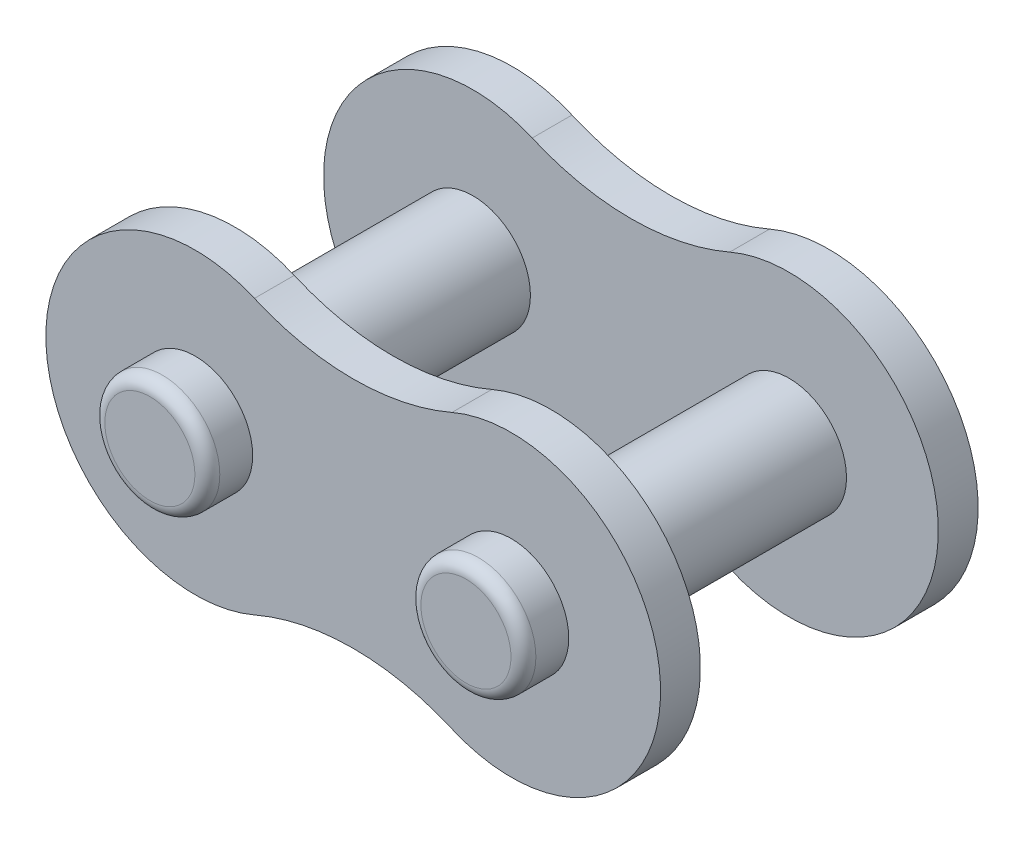
from build123d import *

# Parameters (mm, degrees)
EXTRUDE_1_DEPTH = 0.8
SKETCH_2_R      = 1.155
EXTRUDE_2_DEPTH = 4.78
EXTRUDE_3_DEPTH = 0.8
SKETCH_4_R      = 1.155
EXTRUDE_4_DEPTH = 0.91
EXTRUDE_START   = 0.91
SKETCH_5_R      = 1.155
EXTRUDE_5_DEPTH = 0.91
FILLET_1_R      = 0.25


with BuildPart() as part:
    # 草图1 → 凸台-拉伸1 (new body)
    with BuildSketch(Plane.XY):
        with BuildLine():
            ThreePointArc((1.190625, 2.753618004), (-3, 0), (1.190625, -2.753618004))
            ThreePointArc((1.190625, -2.753618004), (3.175, -2.342981343), (5.159375, -2.753618004))
            ThreePointArc((5.159375, -2.753618004), (9.35, 0), (5.159375, 2.753618004))
            ThreePointArc((5.159375, 2.753618004), (3.175, 2.342981343), (1.190625, 2.753618004))
        make_face()
    extrude(amount=EXTRUDE_1_DEPTH)

    # 草图2 → 凸台-拉伸2 (add)
    with BuildSketch(Plane.XY.offset(0.8)):
        Circle(SKETCH_2_R)
        with Locations((6.35, 0)):
            Circle(SKETCH_2_R)
    extrude(amount=EXTRUDE_2_DEPTH)

    # 草图3 → 凸台-拉伸3 (add)
    with BuildSketch(Plane.XY.offset(5.58)):
        with BuildLine():
            ThreePointArc((5.159375, -2.753618004), (3.175, -2.342981343), (1.190625, -2.753618004))
            ThreePointArc((1.190625, -2.753618004), (-3, 0), (1.190625, 2.753618004))
            ThreePointArc((1.190625, 2.753618004), (3.175, 2.342981343), (5.159375, 2.753618004))
            ThreePointArc((5.159375, 2.753618004), (9.35, 0), (5.159375, -2.753618004))
        make_face()
    extrude(amount=EXTRUDE_3_DEPTH)

    # 草图4 → 凸台-拉伸4 (add)
    with BuildSketch(Plane.XY.offset(6.38)):
        Circle(SKETCH_4_R)
        with Locations((6.35, 0)):
            Circle(SKETCH_4_R)
    extrude(amount=EXTRUDE_4_DEPTH)

    # 草图5 → 凸台-拉伸5 (add)
    with BuildSketch(Plane(origin=(0, 0, 0), x_dir=(-1, 0, 0), z_dir=(0, 0, -1)).offset(EXTRUDE_START)):
        with Locations(Location((0, 0, 0), (0, 0, 180))):
            Circle(SKETCH_5_R)
        with Locations(Location((-6.35, 0, 0), (0, 0, 180))):
            Circle(SKETCH_5_R)
    extrude(amount=-EXTRUDE_5_DEPTH)

    # 圆角1
    fillet_1_edges = [part.edges().sort_by_distance(p)[0] for p in [
        (-1.155, 0, 7.29),
        (5.195, 0, 7.29),
        (-1.155, 0, -0.91),
        (5.195, 0, -0.91),
    ]]
    fillet(fillet_1_edges, radius=FILLET_1_R)


solid = part.part
